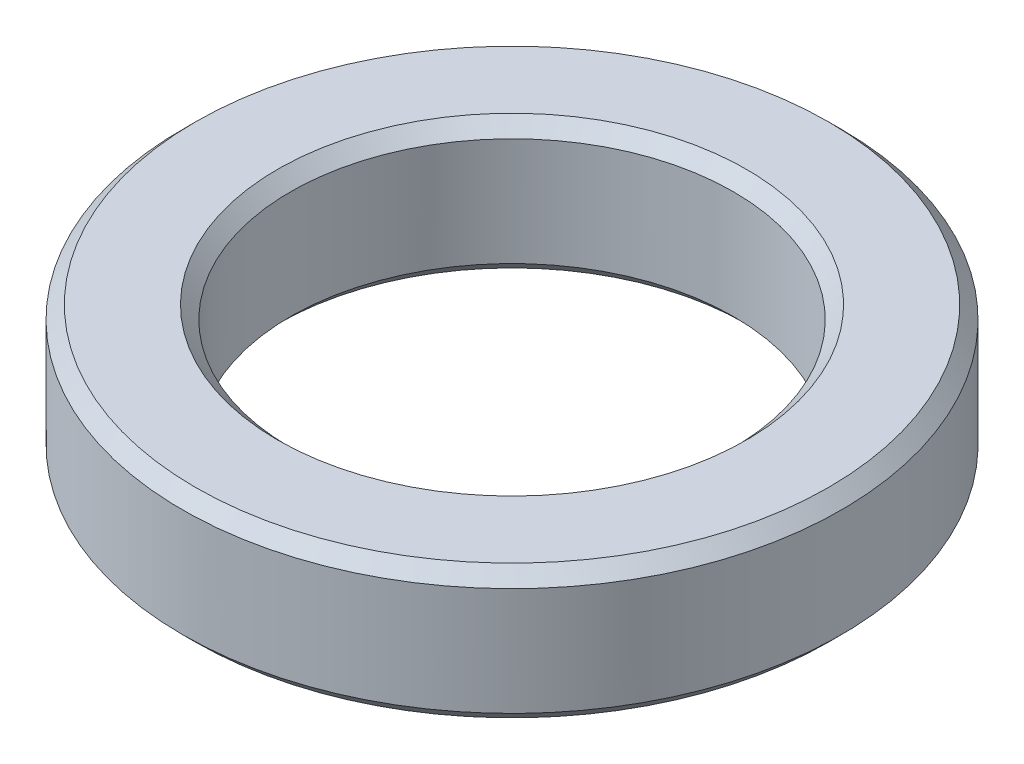
from build123d import *

# Parameters (mm, degrees)
SKETCH1_R           = 15.25
SKETCH1_R_2         = 10.25
BOSS_EXTRUDE1_DEPTH = 6.2
CHAMFER1_SIZE       = 0.6


with BuildPart() as part:
    # Sketch1 → Boss-Extrude1 (new body)
    with BuildSketch(Plane(origin=(0, 0, 0), x_dir=(1, 0, 0), z_dir=(0, 1, 0))):
        with Locations(Location((0, 0, 0), (0, 0, 90))):
            Circle(SKETCH1_R)
        with Locations(Location((0, 0, 0), (0, 0, 90))):
            Circle(SKETCH1_R_2, mode=Mode.SUBTRACT)
    extrude(amount=BOSS_EXTRUDE1_DEPTH)

    # Chamfer1
    chamfer1_edges = [part.edges().sort_by_distance(p)[0] for p in [
        (0, 0, 15.25),
        (0, 6.2, 15.25),
        (0, 0, 10.25),
        (0, 6.2, 10.25),
    ]]
    chamfer(chamfer1_edges, length=CHAMFER1_SIZE)


solid = part.part
